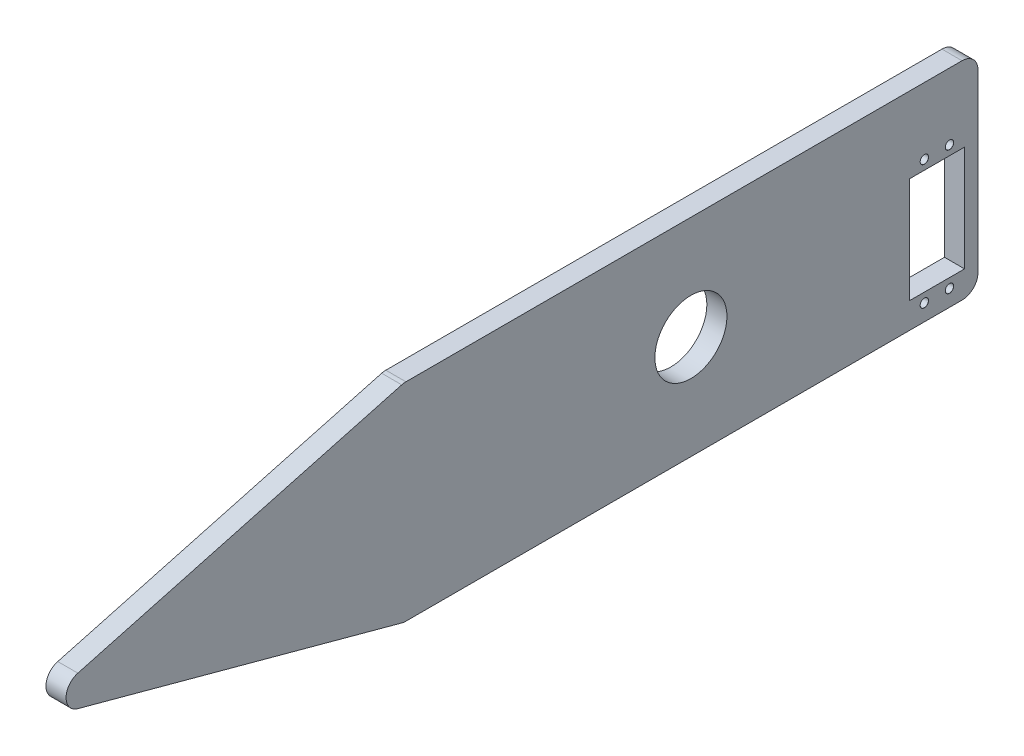
from build123d import *

# Parameters (mm, degrees)
SKETCH1_R                             = 14.351
BOSS_EXTRUDE2_DEPTH                   = 4.0005
FILLET1_R                             = 6.35
TAP_DRILL_FOR_M4X0_7_TAP1_D           = 3.3
TAP_DRILL_FOR_M4X0_7_TAP1_CSINK_D     = 3.35
TAP_DRILL_FOR_M4X0_7_TAP1_CSINK_ANGLE = 90
SKETCH5_W                             = 42
SKETCH5_H                             = 22
CUT_EXTRUDE1_DEPTH                    = 253.287066958


with BuildPart() as part:
    # Sketch1 → Boss-Extrude2 (new, symmetric)
    with BuildSketch(Plane.YZ):
        Polygon((-41.275, 114.3), (-41.275, -114.3), (41.275, -114.3), (41.275, 114.3), (0, 266.7), align=None)
        with Locations(Location((0, 0, 0), (0, 0, 270))):
            Circle(SKETCH1_R, mode=Mode.SUBTRACT)
    extrude(amount=BOSS_EXTRUDE2_DEPTH, both=True)

    # Fillet1
    fillet1_edges = [part.edges().sort_by_distance(p)[0] for p in [
        (0, 0, 266.7),
        (0, 41.275, 114.3),
        (0, 41.275, -114.3),
        (0, -41.275, -114.3),
        (0, -41.275, 114.3),
    ]]
    fillet(fillet1_edges, radius=FILLET1_R)

    # Tap Drill for M4x0.7 Tap1 (through all)
    with Locations(Plane.YZ.offset(4.0005)):
        with Locations((-34.75, -92.95), (-34.75, -102.95), (14.75, -92.95), (14.75, -102.95)):
            CounterSinkHole(TAP_DRILL_FOR_M4X0_7_TAP1_D / 2, TAP_DRILL_FOR_M4X0_7_TAP1_CSINK_D / 2, counter_sink_angle=TAP_DRILL_FOR_M4X0_7_TAP1_CSINK_ANGLE)

    # Sketch5 → Cut-Extrude1 (cut, through all)
    with BuildSketch(Plane.YZ.offset(4.0005)):
        with Locations((-10, -97.95)):
            Rectangle(SKETCH5_W, SKETCH5_H)
    extrude(amount=-CUT_EXTRUDE1_DEPTH, mode=Mode.SUBTRACT)


solid = part.part
